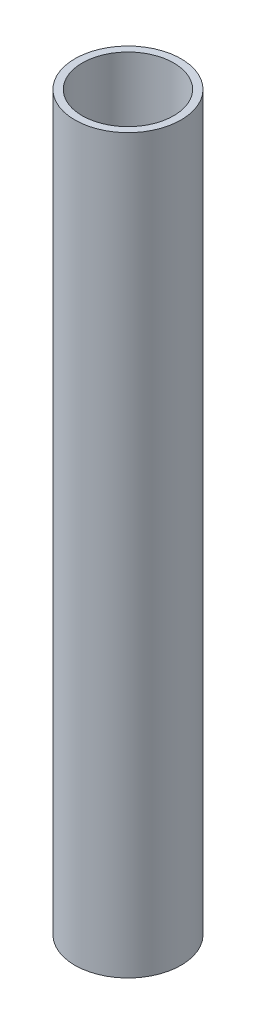
from build123d import *

# Parameters (mm, degrees)
SKETCH2_R           = 7.366
SKETCH2_R_2         = 6.35
BOSS_EXTRUDE1_DEPTH = 101.6


with BuildPart() as part:
    # Sketch2 → Boss-Extrude1 (new body)
    with BuildSketch(Plane(origin=(0, 0, 0), x_dir=(1, 0, 0), z_dir=(0, 1, 0))):
        with Locations(Location((0, 0, 0), (0, 0, 270))):
            Circle(SKETCH2_R)
        with Locations(Location((0, 0, 0), (0, 0, 270))):
            Circle(SKETCH2_R_2, mode=Mode.SUBTRACT)
    extrude(amount=BOSS_EXTRUDE1_DEPTH)


solid = part.part
